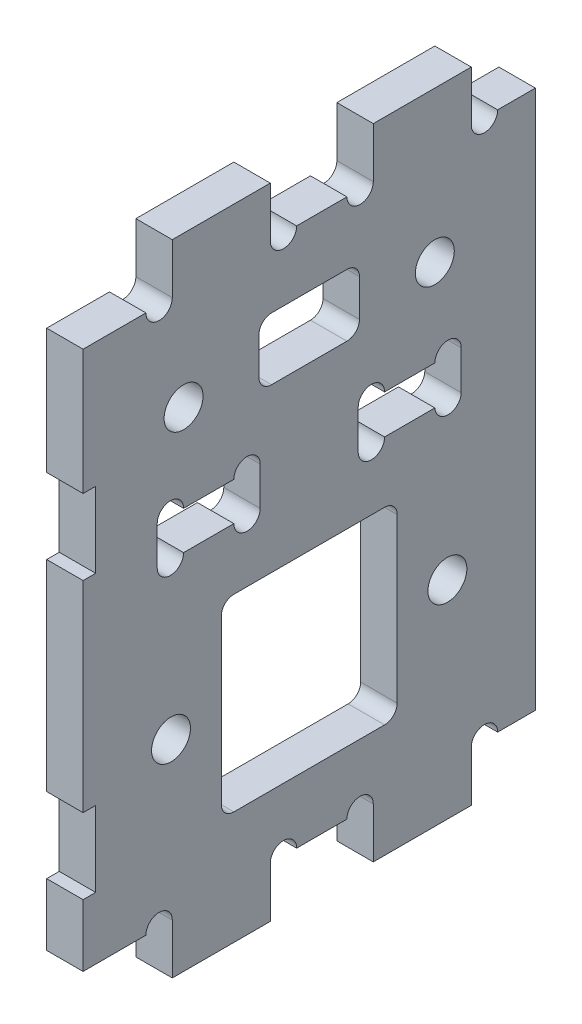
from build123d import *

# Parameters (mm, degrees)
SKETCH_1_R          = 1.55
SKETCH_1_W          = 14
SKETCH_1_H          = 15
EXTRUDE_1_DEPTH     = 2.9
SKETCH_2_R          = 1.55
SKETCH_2_W          = 8
SKETCH_2_H          = 4.95
SKETCH_2_H_2        = 6
CUT_EXTRUDE_1_DEPTH = 10
FILLET_1_R          = 1


with BuildPart() as part:
    # 草图1 → 凸台-拉伸1 (new body)
    with BuildSketch(Plane(origin=(0, 0, 0), x_dir=(0, 0, -1), z_dir=(1, 0, 0))):
        with BuildLine():
            Line((-10.9, 25.45), (-10.9, 21.45))
            ThreePointArc((-10.9, 21.45), (-11.95, 20.4), (-13, 21.45))
            Line((-13, 21.45), (-18, 21.45))
            Line((-18, 21.45), (-18, 16.95))
            Line((-18, 16.95), (-18, 11.95))
            Line((-18, 11.95), (-18, -11.95))
            Line((-18, -11.95), (-18, -16.95))
            Line((-18, -16.95), (-18, -21.45))
            Line((-18, -21.45), (-13, -21.45))
            ThreePointArc((-13, -21.45), (-11.95, -20.4), (-10.9, -21.45))
            Line((-10.9, -21.45), (-10.9, -25.45))
            Line((-10.9, -25.45), (-3.1, -25.45))
            Line((-3.1, -25.45), (-3.1, -21.45))
            ThreePointArc((-3.1, -21.45), (-2.05, -20.4), (-1, -21.45))
            Line((-1, -21.45), (3, -21.45))
            ThreePointArc((3, -21.45), (4.05, -20.4), (5.1, -21.45))
            Line((5.1, -21.45), (5.1, -25.45))
            Line((5.1, -25.45), (12.9, -25.45))
            Line((12.9, -25.45), (12.9, -21.45))
            ThreePointArc((12.9, -21.45), (13.95, -20.4), (15, -21.45))
            Line((15, -21.45), (18, -21.45))
            Line((18, -21.45), (18, 21.45))
            Line((18, 21.45), (15, 21.45))
            ThreePointArc((15, 21.45), (13.95, 20.4), (12.9, 21.45))
            Line((12.9, 21.45), (12.9, 25.45))
            Line((12.9, 25.45), (5.1, 25.45))
            Line((5.1, 25.45), (5.1, 21.45))
            ThreePointArc((5.1, 21.45), (4.05, 20.4), (3, 21.45))
            Line((3, 21.45), (-1, 21.45))
            ThreePointArc((-1, 21.45), (-2.05, 20.4), (-3.1, 21.45))
            Line((-3.1, 21.45), (-3.1, 25.45))
            Line((-3.1, 25.45), (-10.9, 25.45))
        make_face()
        with Locations((-11, -8.95)):
            Circle(SKETCH_1_R, mode=Mode.SUBTRACT)
        with Locations((0, -8.95)):
            Rectangle(SKETCH_1_W, SKETCH_1_H, mode=Mode.SUBTRACT)
        with Locations((11, -8.95)):
            Circle(SKETCH_1_R, mode=Mode.SUBTRACT)
    extrude(amount=EXTRUDE_1_DEPTH)

    # 草图2 → 切除-拉伸1 (cut)
    with BuildSketch(Plane(origin=(2.9, 0, 0), x_dir=(0, 0, -1), z_dir=(1, 0, 0))):
        with Locations((10, 13.45)):
            Circle(SKETCH_2_R)
        with Locations((-10, 13.45)):
            Circle(SKETCH_2_R)
        with BuildLine():
            Line((-12.1, 3.425), (-12.1, 6.475))
            ThreePointArc((-12.1, 6.475), (-11.05, 7.525), (-10, 6.475))
            Line((-10, 6.475), (-6, 6.475))
            ThreePointArc((-6, 6.475), (-4.95, 7.525), (-3.9, 6.475))
            Line((-3.9, 6.475), (-3.9, 3.425))
            ThreePointArc((-3.9, 3.425), (-4.95, 2.375), (-6, 3.425))
            Line((-6, 3.425), (-10, 3.425))
            ThreePointArc((-10, 3.425), (-11.05, 2.375), (-12.1, 3.425))
        make_face()
        with BuildLine():
            Line((12.1, 3.4), (12.1, 6.5))
            ThreePointArc((12.1, 6.5), (11.05, 7.55), (10, 6.5))
            Line((10, 6.5), (6, 6.5))
            ThreePointArc((6, 6.5), (4.95, 7.55), (3.9, 6.5))
            Line((3.9, 6.5), (3.9, 3.4))
            ThreePointArc((3.9, 3.4), (4.95, 2.35), (6, 3.4))
            Line((6, 3.4), (10.002382304, 3.4))
            ThreePointArc((10.002382304, 3.4), (11.051191152, 2.4), (12.1, 3.4))
        make_face()
        with Locations((0, 13.975)):
            Rectangle(SKETCH_2_W, SKETCH_2_H)
        with Locations((-21, 8.5)):
            Rectangle(SKETCH_2_W, SKETCH_2_H_2)
        with Locations((-21, -13.5)):
            Rectangle(SKETCH_2_W, SKETCH_2_H_2)
    extrude(amount=-CUT_EXTRUDE_1_DEPTH, mode=Mode.SUBTRACT)

    # 圆角1
    fillet_1_edges = [part.edges().sort_by_distance(p)[0] for p in [
        (1.45, 16.45, -4),
        (1.45, 11.5, -4),
        (1.45, 11.5, 4),
        (1.45, 16.45, 4),
        (1.45, -16.45, 7),
        (1.45, -16.45, -7),
        (1.45, -1.45, -7),
        (1.45, -1.45, 7),
    ]]
    fillet(fillet_1_edges, radius=FILLET_1_R)


solid = part.part
